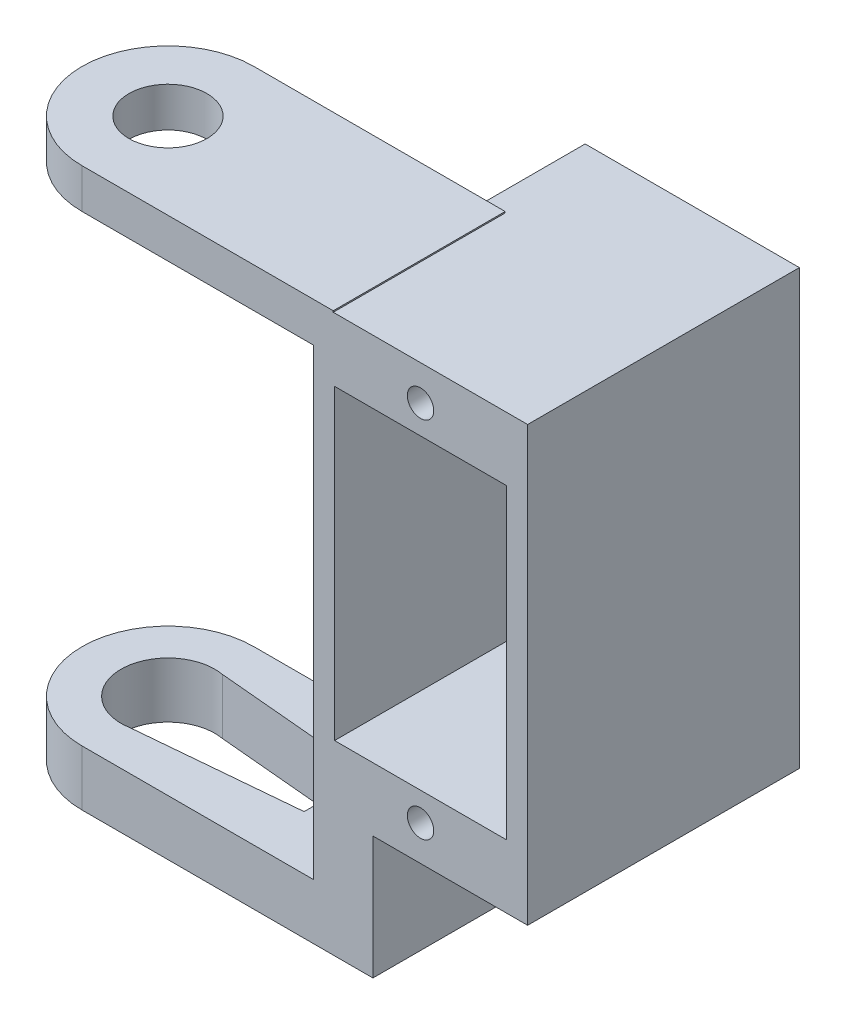
from build123d import *

# Parameters (mm, degrees)
BOSS_EXTRUDE1_START = -3.775
SKETCH1_W           = 16.2
SKETCH1_H           = 32.8
BOSS_EXTRUDE1_DEPTH = 10.275
BOSS_EXTRUDE2_START = -65.25
SKETCH2_W           = 13
SKETCH2_H           = 11.7
BOSS_EXTRUDE2_DEPTH = 2.25
BOSS_EXTRUDE3_START = -82.6
SKETCH3_R           = 6.5
BOSS_EXTRUDE3_DEPTH = 2.1
BOSS_EXTRUDE4_START = -82.6
SKETCH4_W           = 19
SKETCH4_H           = 13
BOSS_EXTRUDE4_DEPTH = 2.1
CUT_EXTRUDE1_START  = -82.6
SKETCH5_R           = 3.55
CUT_EXTRUDE1_DEPTH  = 2.1
CUT_EXTRUDE2_START  = -82.6
CUT_EXTRUDE2_DEPTH  = 2.1
BOSS_EXTRUDE5_START = -44
SKETCH7_R           = 6.5
BOSS_EXTRUDE5_DEPTH = 1.5
BOSS_EXTRUDE6_START = -44
SKETCH8_W           = 19
SKETCH8_H           = 13
BOSS_EXTRUDE6_DEPTH = 1.5
CUT_EXTRUDE3_START  = -44
SKETCH9_R           = 2.95
CUT_EXTRUDE3_DEPTH  = 1.5
CUT_EXTRUDE4_START  = -2.125
SKETCH10_W          = 13
SKETCH10_H          = 23.2
CUT_EXTRUDE4_DEPTH  = 8.625
CUT_EXTRUDE5_START  = 3.5
SKETCH11_R          = 1
CUT_EXTRUDE5_DEPTH  = 3
CUT_EXTRUDE6_START  = 3.5
SKETCH12_R          = 1
CUT_EXTRUDE6_DEPTH  = 3
CUT_EXTRUDE7_START  = -12.75
SKETCH13_R          = 3.15
CUT_EXTRUDE7_DEPTH  = 1.3
CUT_EXTRUDE8_START  = -73
SKETCH14_W          = 4.4
SKETCH14_H          = 6
CUT_EXTRUDE8_DEPTH  = 2.4


with BuildPart() as part:
    # Sketch1 → Boss-Extrude1 (new, symmetric)
    with BuildSketch(Plane.XY.offset(BOSS_EXTRUDE1_START)):
        with Locations((-59.4, -59)):
            Rectangle(SKETCH1_W, SKETCH1_H)
    extrude(amount=BOSS_EXTRUDE1_DEPTH, both=True)

    # Sketch2 → Boss-Extrude2 (add, symmetric)
    with BuildSketch(Plane(origin=(0, 0, 0), x_dir=(0, 0, -1), z_dir=(1, 0, 0)).offset(BOSS_EXTRUDE2_START)):
        with Locations((0, -78.85)):
            Rectangle(SKETCH2_W, SKETCH2_H)
    extrude(amount=BOSS_EXTRUDE2_DEPTH, both=True)



with BuildPart() as body_2:
    # Sketch3 → Boss-Extrude3 (new, symmetric)
    with BuildSketch(Plane(origin=(0, 0, 0), x_dir=(1, 0, 0), z_dir=(0, 1, 0)).offset(BOSS_EXTRUDE3_START)):
        with Locations(Location((-85, 0, 0), (0, 0, 270))):
            Circle(SKETCH3_R)
    extrude(amount=BOSS_EXTRUDE3_DEPTH, both=True)


with BuildPart() as part_1:
    add(part.part)

    add(body_2.part)  # Boss-Extrude4 merges body 2
    # Sketch4 → Boss-Extrude4 (add, symmetric)
    with BuildSketch(Plane(origin=(0, 0, 0), x_dir=(1, 0, 0), z_dir=(0, 1, 0)).offset(BOSS_EXTRUDE4_START)):
        with Locations((-75.5, 0)):
            Rectangle(SKETCH4_W, SKETCH4_H)
    extrude(amount=BOSS_EXTRUDE4_DEPTH, both=True)

    # Sketch5 → Cut-Extrude1 (cut, symmetric)
    with BuildSketch(Plane(origin=(0, 0, 0), x_dir=(1, 0, 0), z_dir=(0, 1, 0)).offset(CUT_EXTRUDE1_START)):
        with Locations(Location((-85, 0, 0), (0, 0, 270))):
            Circle(SKETCH5_R)
    extrude(amount=CUT_EXTRUDE1_DEPTH, both=True, mode=Mode.SUBTRACT)

    # Sketch6 → Cut-Extrude2 (cut, symmetric)
    with BuildSketch(Plane(origin=(0, 0, 0), x_dir=(1, 0, 0), z_dir=(0, 1, 0)).offset(CUT_EXTRUDE2_START)):
        Polygon((-85, -3.55), (-72.3, -2.403281405), (-72.3, 2.403281405), (-85, 3.55), align=None)
    extrude(amount=CUT_EXTRUDE2_DEPTH, both=True, mode=Mode.SUBTRACT)



with BuildPart() as body_2_2:
    # Sketch7 → Boss-Extrude5 (new, symmetric)
    with BuildSketch(Plane(origin=(0, 0, 0), x_dir=(1, 0, 0), z_dir=(0, 1, 0)).offset(BOSS_EXTRUDE5_START)):
        with Locations(Location((-85, 0, 0), (0, 0, 270))):
            Circle(SKETCH7_R)
    extrude(amount=BOSS_EXTRUDE5_DEPTH, both=True)


with BuildPart() as part_2:
    add(part_1.part)

    add(body_2_2.part)  # Boss-Extrude6 merges body 2 2
    # Sketch8 → Boss-Extrude6 (add, symmetric)
    with BuildSketch(Plane(origin=(0, 0, 0), x_dir=(1, 0, 0), z_dir=(0, 1, 0)).offset(BOSS_EXTRUDE6_START)):
        with Locations((-75.5, 0)):
            Rectangle(SKETCH8_W, SKETCH8_H)
    extrude(amount=BOSS_EXTRUDE6_DEPTH, both=True)

    # Sketch9 → Cut-Extrude3 (cut, symmetric)
    with BuildSketch(Plane(origin=(0, 0, 0), x_dir=(1, 0, 0), z_dir=(0, 1, 0)).offset(CUT_EXTRUDE3_START)):
        with Locations(Location((-85, 0, 0), (0, 0, 270))):
            Circle(SKETCH9_R)
    extrude(amount=CUT_EXTRUDE3_DEPTH, both=True, mode=Mode.SUBTRACT)

    # Sketch10 → Cut-Extrude4 (cut, symmetric)
    with BuildSketch(Plane.XY.offset(CUT_EXTRUDE4_START)):
        with Locations((-59.4, -59)):
            Rectangle(SKETCH10_W, SKETCH10_H)
    extrude(amount=CUT_EXTRUDE4_DEPTH, both=True, mode=Mode.SUBTRACT)

    # Sketch11 → Cut-Extrude5 (cut, symmetric)
    with BuildSketch(Plane.XY.offset(CUT_EXTRUDE5_START)):
        with Locations((-59.4, -45.25)):
            Circle(SKETCH11_R)
    extrude(amount=CUT_EXTRUDE5_DEPTH, both=True, mode=Mode.SUBTRACT)

    # Sketch12 → Cut-Extrude6 (cut, symmetric)
    with BuildSketch(Plane.XY.offset(CUT_EXTRUDE6_START)):
        with Locations((-59.4, -72.75)):
            Circle(SKETCH12_R)
    extrude(amount=CUT_EXTRUDE6_DEPTH, both=True, mode=Mode.SUBTRACT)

    # Sketch13 → Cut-Extrude7 (cut, symmetric)
    with BuildSketch(Plane.XY.offset(CUT_EXTRUDE7_START)):
        with Locations((-59.4, -64.5)):
            Circle(SKETCH13_R)
    extrude(amount=CUT_EXTRUDE7_DEPTH, both=True, mode=Mode.SUBTRACT)

    # Sketch14 → Cut-Extrude8 (cut, symmetric)
    with BuildSketch(Plane(origin=(0, 0, 0), x_dir=(1, 0, 0), z_dir=(0, 1, 0)).offset(CUT_EXTRUDE8_START)):
        with Locations((-59.4, 7.75)):
            Rectangle(SKETCH14_W, SKETCH14_H)
    extrude(amount=CUT_EXTRUDE8_DEPTH, both=True, mode=Mode.SUBTRACT)


solid = part_2.part
